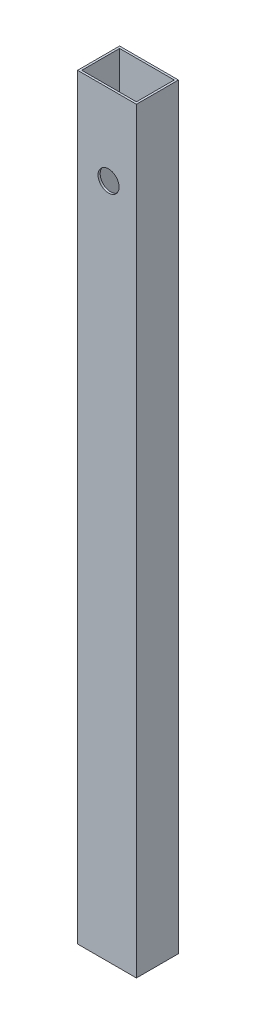
from build123d import *

# Parameters (mm, degrees)
SKETCH1_W           = 35.56
SKETCH1_H           = 25.4
BOSS_EXTRUDE1_DEPTH = 457.2
SKETCH2_W           = 33.02
SKETCH2_H           = 22.86
CUT_EXTRUDE1_DEPTH  = 458.721813332
CUT_EXTRUDE2_REACH  = 460.25
SKETCH3_R           = 6.35
CUT_EXTRUDE3_REACH  = 460.25
SKETCH4_R           = 6.35


with BuildPart() as part:
    # Sketch1 → Boss-Extrude1 (new body)
    with BuildSketch(Plane(origin=(0, 0, 0), x_dir=(1, 0, 0), z_dir=(0, 1, 0))):
        Rectangle(SKETCH1_W, SKETCH1_H)
    extrude(amount=BOSS_EXTRUDE1_DEPTH)

    # Sketch2 → Cut-Extrude1 (cut, through all)
    with BuildSketch(Plane(origin=(0, 457.2, 0), x_dir=(1, 0, 0), z_dir=(0, 1, 0))):
        Rectangle(SKETCH2_W, SKETCH2_H)
    extrude(amount=-CUT_EXTRUDE1_DEPTH, mode=Mode.SUBTRACT)

    # Sketch3 → Cut-Extrude2 (cut, up to next)
    with BuildSketch(Plane.XY.offset(12.7), mode=Mode.PRIVATE) as cut_extrude2_sk1:
        with Locations((0.954776226, 408.643423165)):
            Circle(SKETCH3_R)
    cut_extrude2_tool1 = extrude(cut_extrude2_sk1.sketch, amount=-CUT_EXTRUDE2_REACH, mode=Mode.PRIVATE) & part.part
    add(cut_extrude2_tool1.solids().sort_by_distance((0.954776, 408.643423, 12.7))[0], mode=Mode.SUBTRACT)

    # Sketch4 → Cut-Extrude3 (cut, up to next)
    with BuildSketch(Plane(origin=(0, 0, -12.7), x_dir=(-1, 0, 0), z_dir=(0, 0, -1)), mode=Mode.PRIVATE) as cut_extrude3_sk1:
        with Locations(Location((-0.954776226, 408.643423165, 0), (0, 0, 180))):
            Circle(SKETCH4_R)
    cut_extrude3_tool1 = extrude(cut_extrude3_sk1.sketch, amount=-CUT_EXTRUDE3_REACH, mode=Mode.PRIVATE) & part.part
    add(cut_extrude3_tool1.solids().sort_by_distance((0.954776, 408.643423, -12.7))[0], mode=Mode.SUBTRACT)


solid = part.part
